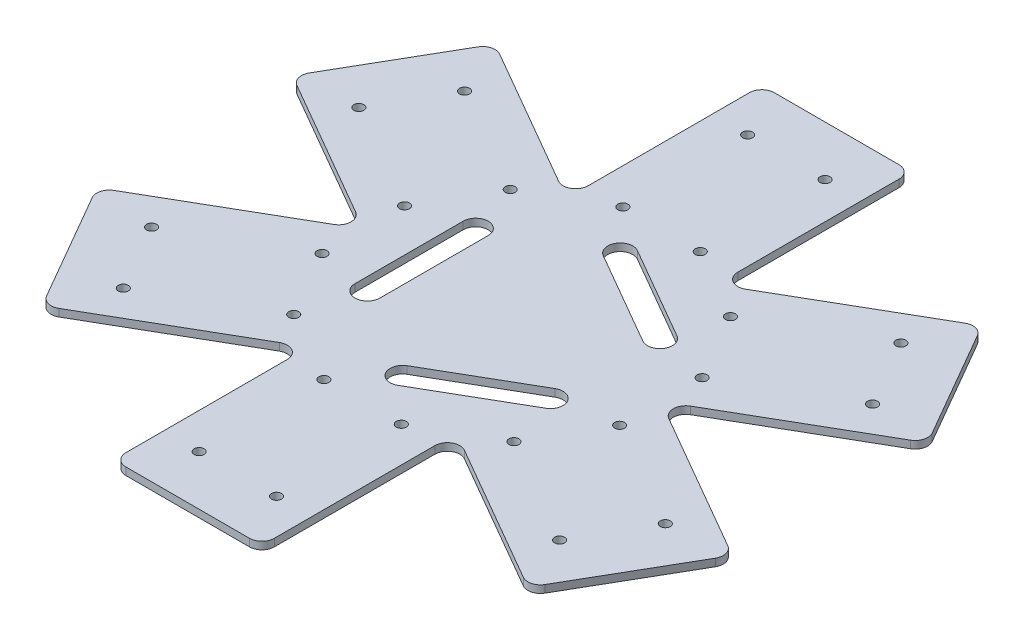
from build123d import *

# Parameters (mm, degrees)
ESQUISSE1_R             = 2
BOSS_EXTRU_1_DEPTH      = 3
CONG_2_R                = 10
CONG_3_R                = 10
ENL_V_MAT_EXTRU_1_DEPTH = 198.287332615
CONG_4_R                = 5


with BuildPart() as part:
    # Esquisse1 → Boss.-Extru.1 (new body)
    with BuildSketch(Plane(origin=(0, 0, 0), x_dir=(1, 0, 0), z_dir=(0, 1, 0))):
        Polygon((-150, 0), (-75, -129.903810568), (75, -129.903810568), (150, 0), (75, 129.903810568), (-75, 129.903810568), align=None)
        with Locations(Location((15.5, -109.903810568, 0), (0, 0, 270))):
            Circle(ESQUISSE1_R, mode=Mode.SUBTRACT)
        with Locations(Location((-15.5, -109.903810568, 0), (0, 0, 90))):
            Circle(ESQUISSE1_R, mode=Mode.SUBTRACT)
        with Locations(Location((15.5, -59.903810568, 0), (0, 0, 270))):
            Circle(ESQUISSE1_R, mode=Mode.SUBTRACT)
        with Locations(Location((-15.5, -59.903810568, 0), (0, 0, 90))):
            Circle(ESQUISSE1_R, mode=Mode.SUBTRACT)
        with Locations(Location((-87.429491924, -68.375299042, 0), (0, 0, 270))):
            Circle(ESQUISSE1_R, mode=Mode.SUBTRACT)
        with Locations(Location((-102.929491924, -41.528511525, 0), (0, 0, 90))):
            Circle(ESQUISSE1_R, mode=Mode.SUBTRACT)
        with Locations(Location((-59.628221735, -16.528511525, 0), (0, 0, 90))):
            Circle(ESQUISSE1_R, mode=Mode.SUBTRACT)
        with Locations(Location((-44.128221735, -43.375299042, 0), (0, 0, 270))):
            Circle(ESQUISSE1_R, mode=Mode.SUBTRACT)
        with Locations(Location((-102.929491924, 41.528511525, 0), (0, 0, 270))):
            Circle(ESQUISSE1_R, mode=Mode.SUBTRACT)
        with Locations(Location((-87.429491924, 68.375299042, 0), (0, 0, 90))):
            Circle(ESQUISSE1_R, mode=Mode.SUBTRACT)
        with Locations(Location((-44.128221735, 43.375299042, 0), (0, 0, 90))):
            Circle(ESQUISSE1_R, mode=Mode.SUBTRACT)
        with Locations(Location((-59.628221735, 16.528511525, 0), (0, 0, 270))):
            Circle(ESQUISSE1_R, mode=Mode.SUBTRACT)
        with Locations(Location((-15.5, 109.903810568, 0), (0, 0, 270))):
            Circle(ESQUISSE1_R, mode=Mode.SUBTRACT)
        with Locations(Location((15.5, 109.903810568, 0), (0, 0, 90))):
            Circle(ESQUISSE1_R, mode=Mode.SUBTRACT)
        with Locations(Location((15.5, 59.903810568, 0), (0, 0, 90))):
            Circle(ESQUISSE1_R, mode=Mode.SUBTRACT)
        with Locations(Location((-15.5, 59.903810568, 0), (0, 0, 270))):
            Circle(ESQUISSE1_R, mode=Mode.SUBTRACT)
        with Locations(Location((87.429491924, 68.375299042, 0), (0, 0, 270))):
            Circle(ESQUISSE1_R, mode=Mode.SUBTRACT)
        with Locations(Location((102.929491924, 41.528511525, 0), (0, 0, 90))):
            Circle(ESQUISSE1_R, mode=Mode.SUBTRACT)
        with Locations(Location((59.628221735, 16.528511525, 0), (0, 0, 90))):
            Circle(ESQUISSE1_R, mode=Mode.SUBTRACT)
        with Locations(Location((44.128221735, 43.375299042, 0), (0, 0, 270))):
            Circle(ESQUISSE1_R, mode=Mode.SUBTRACT)
        with Locations(Location((102.929491924, -41.528511525, 0), (0, 0, 270))):
            Circle(ESQUISSE1_R, mode=Mode.SUBTRACT)
        with Locations(Location((87.429491924, -68.375299042, 0), (0, 0, 90))):
            Circle(ESQUISSE1_R, mode=Mode.SUBTRACT)
        with Locations(Location((44.128221735, -43.375299042, 0), (0, 0, 90))):
            Circle(ESQUISSE1_R, mode=Mode.SUBTRACT)
        with Locations(Location((59.628221735, -16.528511525, 0), (0, 0, 270))):
            Circle(ESQUISSE1_R, mode=Mode.SUBTRACT)
    extrude(amount=BOSS_EXTRU_1_DEPTH)

    # Congé2
    cong_2_edges = [part.edges().sort_by_distance(p)[0] for p in [
        (-75, 1.5, -129.903810568),
    ]]
    fillet(cong_2_edges, radius=CONG_2_R)

    # Congé3
    cong_3_edges = [part.edges().sort_by_distance(p)[0] for p in [
        (75, 1.5, -129.903810568),
        (150, 1.5, 0),
        (75, 1.5, 129.903810568),
        (-75, 1.5, 129.903810568),
        (-150, 1.5, 0),
    ]]
    fillet(cong_3_edges, radius=CONG_3_R)

    # Esquisse3 → Enlèv. mat.-Extru.1 (cut, through all)
    with BuildSketch(Plane(origin=(0, 3, 0), x_dir=(1, 0, 0), z_dir=(0, 1, 0))):
        with BuildLine():
            Line((-69.226497308, -129.903810568), (-29.814110868, -129.903810568))
            Line((-29.814110868, -129.903810568), (-29.814110868, -51.639554805))
            Line((-29.814110868, -51.639554805), (-97.592944566, -90.771682686))
            Line((-97.592944566, -90.771682686), (-77.886751346, -124.903810568))
            ThreePointArc((-77.886751346, -124.903810568), (-74.226497308, -128.564064606), (-69.226497308, -129.903810568))
        make_face()
        with BuildLine():
            Line((-147.113248654, -5), (-127.5737221, -38.843452747))
            Line((-127.5737221, -38.843452747), (-59.794888402, 0.288675135))
            Line((-59.794888402, 0.288675135), (-127.0737221, 39.132127881))
            Line((-127.0737221, 39.132127881), (-127.3237221, 39.276465449))
            Line((-127.3237221, 39.276465449), (-147.113248654, 5))
            ThreePointArc((-147.113248654, 5), (-148.452994616, 0), (-147.113248654, -5))
        make_face()
        with BuildLine():
            Line((-77.886751346, 124.903810568), (-97.592944566, 90.771682686))
            Line((-97.592944566, 90.771682686), (-97.092944566, 90.483007552))
            Line((-97.092944566, 90.483007552), (-29.814110868, 51.639554805))
            Line((-29.814110868, 51.639554805), (-29.814110868, 129.903810568))
            Line((-29.814110868, 129.903810568), (-69.226497308, 129.903810568))
            ThreePointArc((-69.226497308, 129.903810568), (-74.226497308, 128.564064606), (-77.886751346, 124.903810568))
        make_face()
        with BuildLine():
            Line((30.147444201, 51.639554805), (97.6762779, 90.627345119))
            Line((97.6762779, 90.627345119), (77.886751346, 124.903810568))
            ThreePointArc((77.886751346, 124.903810568), (74.226497308, 128.564064606), (69.226497308, 129.903810568))
            Line((69.226497308, 129.903810568), (30.147444201, 129.903810568))
            Line((30.147444201, 129.903810568), (30.147444201, 129.326460298))
            Line((30.147444201, 129.326460298), (30.147444201, 51.639554805))
        make_face()
        with BuildLine():
            Line((60.128221735, -0.288675135), (127.407055434, -39.132127881))
            Line((127.407055434, -39.132127881), (147.113248654, -5))
            ThreePointArc((147.113248654, -5), (148.452994616, 0), (147.113248654, 5))
            Line((147.113248654, 5), (127.407055434, 39.132127881))
            Line((127.407055434, 39.132127881), (59.628221735, 0))
            Line((59.628221735, 0), (60.128221735, -0.288675135))
        make_face()
        with BuildLine():
            Line((29.647444201, -51.92822994), (29.647444201, -129.903810568))
            Line((29.647444201, -129.903810568), (69.226497308, -129.903810568))
            ThreePointArc((69.226497308, -129.903810568), (74.226497308, -128.564064606), (77.886751346, -124.903810568))
            Line((77.886751346, -124.903810568), (97.4262779, -91.060357821))
            Line((97.4262779, -91.060357821), (29.647444201, -51.92822994))
        make_face()
        with BuildLine():
            Line((-32.564110868, -20.388611416), (-32.564110868, 22.986687627))
            ThreePointArc((-32.564110868, 22.986687627), (-37.564110868, 27.986687627), (-42.564110868, 22.986687627))
            Line((-42.564110868, 22.986687627), (-42.564110868, -20.388611416))
            ThreePointArc((-42.564110868, -20.388611416), (-37.564110868, -25.388611416), (-32.564110868, -20.388611416))
        make_face()
        with BuildLine():
            Line((33.939110868, -16.708003449), (-3.625, -38.395652971))
            ThreePointArc((-3.625, -38.395652971), (-5.455127019, -45.22577999), (1.375, -47.055907009))
            Line((1.375, -47.055907009), (38.939110868, -25.368257487))
            ThreePointArc((38.939110868, -25.368257487), (40.769237886, -18.538130468), (33.939110868, -16.708003449))
        make_face()
        with BuildLine():
            Line((-2.5, 39.045172024), (35.064110868, 17.357522502))
            ThreePointArc((35.064110868, 17.357522502), (41.894237886, 19.187649521), (40.064110868, 26.01777654))
            Line((40.064110868, 26.01777654), (2.5, 47.705426061))
            ThreePointArc((2.5, 47.705426061), (-4.330127019, 45.875299042), (-2.5, 39.045172024))
        make_face()
    extrude(amount=-ENL_V_MAT_EXTRU_1_DEPTH, mode=Mode.SUBTRACT)

    # Congé4
    cong_4_edges = [part.edges().sort_by_distance(p)[0] for p in [
        (-127.5737221, 1.5, 38.843452747),
        (-127.3237221, 1.5, -39.276465449),
        (-59.794888402, 1.5, -0.288675135),
        (-97.592944566, 1.5, -90.771682686),
        (-29.814110868, 1.5, -129.903810568),
        (-29.814110868, 1.5, -51.639554805),
        (30.147444201, 1.5, -129.903810568),
        (97.6762779, 1.5, -90.627345119),
        (30.147444201, 1.5, -51.639554805),
        (127.407055434, 1.5, -39.132127881),
        (127.407055434, 1.5, 39.132127881),
        (59.628221735, 1.5, 0),
        (97.4262779, 1.5, 91.060357821),
        (29.647444201, 1.5, 129.903810568),
        (29.647444201, 1.5, 51.92822994),
        (-29.814110868, 1.5, 51.639554805),
        (-29.814110868, 1.5, 129.903810568),
        (-97.592944566, 1.5, 90.771682686),
    ]]
    fillet(cong_4_edges, radius=CONG_4_R)


solid = part.part
